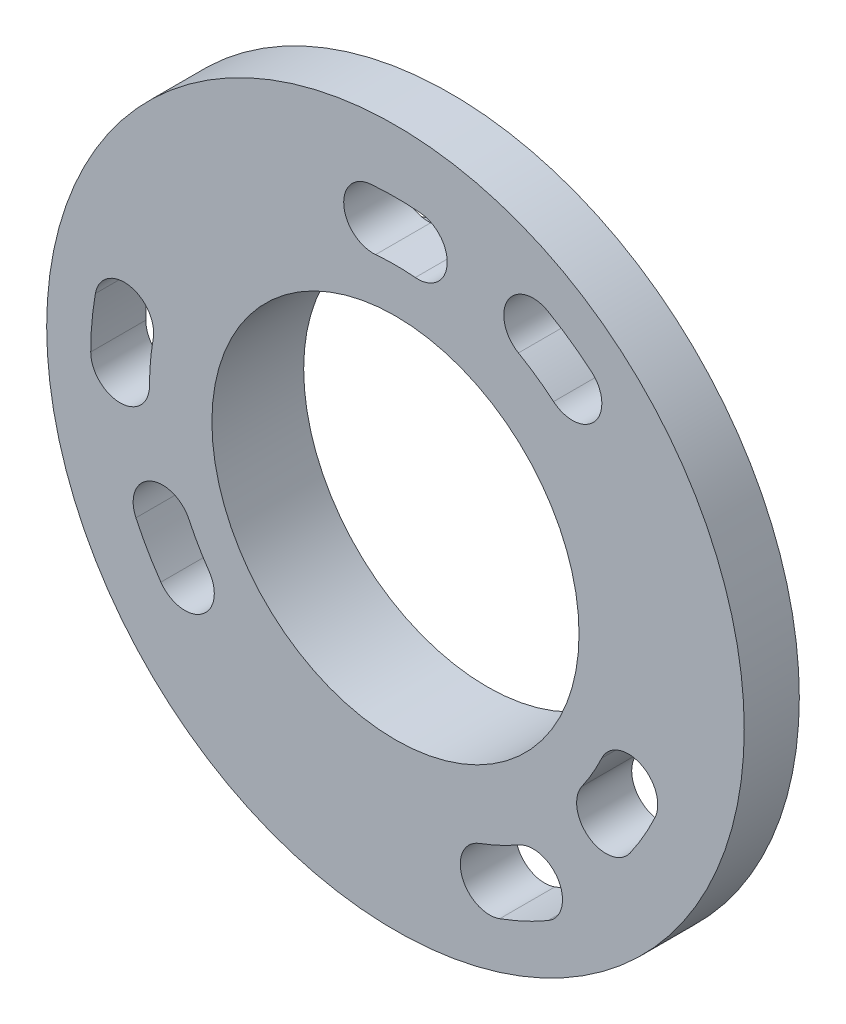
from build123d import *
from build123d.topology import SkipClean

# Parameters (mm, degrees)
SKETCH1_R           = 19
SKETCH1_R_2         = 10
BOSS_EXTRUDE1_DEPTH = 3
BOSS_EXTRUDE2_START = 2
SKETCH2_R           = 11
SKETCH2_R_2         = 10
BOSS_EXTRUDE2_DEPTH = 2


with BuildPart() as part:
    # Sketch1 → Boss-Extrude1 (new body)
    with BuildSketch(Plane.XY):
        Circle(SKETCH1_R)
        Circle(SKETCH1_R_2, mode=Mode.SUBTRACT)
        with BuildLine():
            ThreePointArc((1.359629587, 15.54063729), (0, 15.6), (-1.359629587, 15.54063729))
            ThreePointArc((-1.359629587, 15.54063729), (-2.814091915, 13.807276585), (-1.08073121, 12.352814256))
            ThreePointArc((-1.08073121, 12.352814256), (0, 12.4), (1.08073121, 12.352814256))
            ThreePointArc((1.08073121, 12.352814256), (2.814091915, 13.807276585), (1.359629587, 15.54063729))
        make_face(mode=Mode.SUBTRACT)
        with BuildLine():
            ThreePointArc((10.670274321, 12.716337756), (9.521368843, 13.597923935), (8.3, 14.376021703))
            ThreePointArc((8.3, 14.376021703), (6.114359354, 13.790381057), (6.7, 11.604740411))
            ThreePointArc((6.7, 11.604740411), (7.685924247, 10.976637393), (8.61335397, 10.264995538))
            ThreePointArc((8.61335397, 10.264995538), (10.867485254, 10.462206471), (10.670274321, 12.716337756))
        make_face(mode=Mode.SUBTRACT)
        with BuildLine():
            ThreePointArc((12.778771891, -8.947792407), (13.509996299, -7.8), (14.138401478, -6.592844883))
            ThreePointArc((14.138401478, -6.592844883), (13.364498237, -4.466563205), (11.238216559, -5.240466446))
            ThreePointArc((11.238216559, -5.240466446), (10.738715007, -6.2), (10.157485349, -7.112347811))
            ThreePointArc((10.157485349, -7.112347811), (10.550406322, -9.34071338), (12.778771891, -8.947792407))
        make_face(mode=Mode.SUBTRACT)
        with BuildLine():
            ThreePointArc((5.677534379, -15.598897505), (7.015463145, -15.044709265), (8.3, -14.376021703))
            ThreePointArc((8.3, -14.376021703), (8.885640646, -12.190381057), (6.7, -11.604740411))
            ThreePointArc((6.7, -11.604740411), (5.663084707, -12.144524346), (4.583069921, -12.591881119))
            ThreePointArc((4.583069921, -12.591881119), (3.626793957, -14.642621541), (5.677534379, -15.598897505))
        make_face(mode=Mode.SUBTRACT)
        with BuildLine():
            ThreePointArc((-14.138401478, -6.592844883), (-13.509996299, -7.8), (-12.778771891, -8.947792407))
            ThreePointArc((-12.778771891, -8.947792407), (-10.550406322, -9.34071338), (-10.157485349, -7.112347811))
            ThreePointArc((-10.157485349, -7.112347811), (-10.738715007, -6.2), (-11.238216559, -5.240466446))
            ThreePointArc((-11.238216559, -5.240466446), (-13.364498237, -4.466563205), (-14.138401478, -6.592844883))
        make_face(mode=Mode.SUBTRACT)
        with BuildLine():
            ThreePointArc((-16.3478087, 2.882559749), (-16.536831988, 1.44678533), (-16.6, 0))
            ThreePointArc((-16.6, 0), (-15, -1.6), (-13.4, 0))
            ThreePointArc((-13.4, 0), (-13.349008954, 1.167886953), (-13.19642389, 2.326885581))
            ThreePointArc((-13.19642389, 2.326885581), (-14.494279211, 4.18041507), (-16.3478087, 2.882559749))
        make_face(mode=Mode.SUBTRACT)
    extrude(amount=BOSS_EXTRUDE1_DEPTH)

    # Sketch2 → Boss-Extrude2 (add)
    with SkipClean():  # the faces are left unmerged after this step: merging them gives an invalid solid
        with BuildSketch(Plane(origin=(0, 0, 0), x_dir=(-1, 0, 0), z_dir=(0, 0, -1)).offset(BOSS_EXTRUDE2_START)):
            with Locations(Location((0, 0, 0), (0, 0, 180))):
                Circle(SKETCH2_R)
            Circle(SKETCH2_R_2, mode=Mode.SUBTRACT)
        extrude(amount=-BOSS_EXTRUDE2_DEPTH)


solid = part.part
